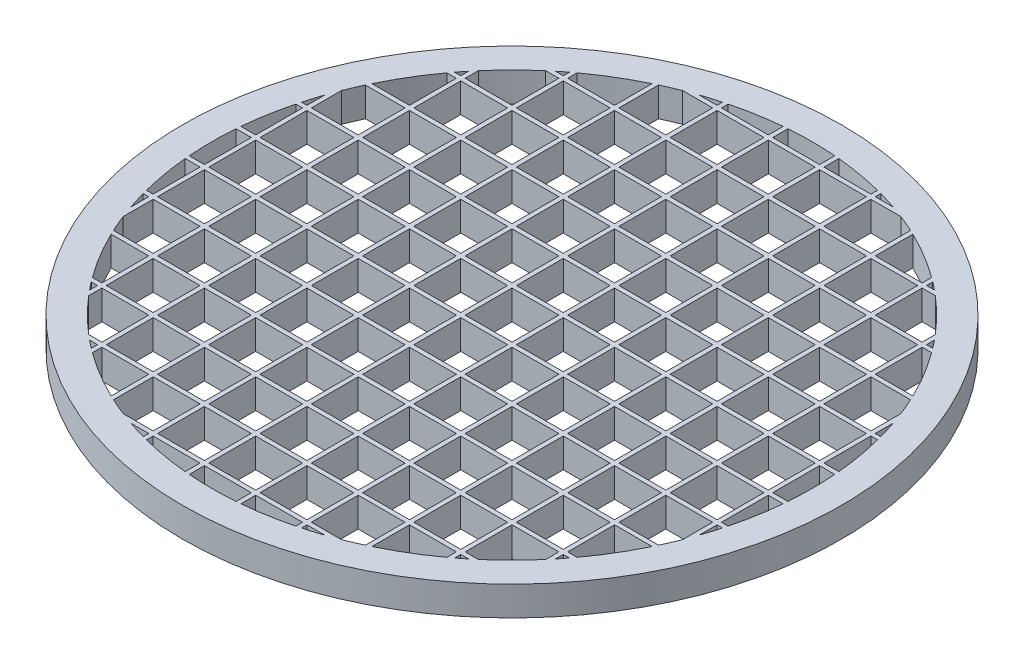
from build123d import *

# Parameters (mm, degrees)
SKETCH_1_R               = 2250
EXTRUDE_1_DEPTH          = 100
EXTRUDE_START            = 100
SKETCH_4_R               = 2250
EXTRUDE_2_DEPTH          = 100
SKETCH_9_W               = 320
SKETCH_9_H               = 320
CUT_EXTRUDE_5_DEPTH      = 3260.601202601
PATTERN_CIRCULAR_1_COUNT = 4
SKETCH_10_R              = 2250
SKETCH_10_R_2            = 2050
EXTRUDE_3_DEPTH          = 200


with BuildPart() as part:
    # ｽｹｯﾁ1 → ﾎﾞｽ - 押し出し1 (new body)
    with BuildSketch(Plane(origin=(0, 0, 0), x_dir=(1, 0, 0), z_dir=(0, 1, 0))):
        with Locations(Location((0, 0, 0), (0, 0, 270))):
            Circle(SKETCH_1_R)
    extrude(amount=-EXTRUDE_1_DEPTH)

    # ｽｹｯﾁ4 → ﾎﾞｽ - 押し出し2 (add)
    with BuildSketch(Plane(origin=(0, 0, 0), x_dir=(1, 0, 0), z_dir=(0, 1, 0)).offset(EXTRUDE_START)):
        with Locations(Location((0, 0, 0), (0, 0, 270))):
            Circle(SKETCH_4_R)
    extrude(amount=-EXTRUDE_2_DEPTH)

    # ｽｹｯﾁ9 → ｶｯﾄ - 押し出し5 (cut, through all)
    with BuildSketch(Plane(origin=(0, 100, 100), x_dir=(1, 0, 0), z_dir=(0, 1, 0))):
        with Locations((0, 100)):
            Rectangle(SKETCH_9_W, SKETCH_9_H)
        with Locations((350, 100)):
            Rectangle(SKETCH_9_W, SKETCH_9_H)
        with Locations((700, 100)):
            Rectangle(SKETCH_9_W, SKETCH_9_H)
        with Locations((1050, 100)):
            Rectangle(SKETCH_9_W, SKETCH_9_H)
        with Locations((1400, 100)):
            Rectangle(SKETCH_9_W, SKETCH_9_H)
        with Locations((1750, 100)):
            Rectangle(SKETCH_9_W, SKETCH_9_H)
        with Locations((2100, 100)):
            Rectangle(SKETCH_9_W, SKETCH_9_H)
        with Locations((350, 450)):
            Rectangle(SKETCH_9_W, SKETCH_9_H)
        with Locations((700, 450)):
            Rectangle(SKETCH_9_W, SKETCH_9_H)
        with Locations((1050, 450)):
            Rectangle(SKETCH_9_W, SKETCH_9_H)
        with Locations((1400, 450)):
            Rectangle(SKETCH_9_W, SKETCH_9_H)
        with Locations((1750, 450)):
            Rectangle(SKETCH_9_W, SKETCH_9_H)
        with Locations((2100, 450)):
            Rectangle(SKETCH_9_W, SKETCH_9_H)
        with Locations((350, 800)):
            Rectangle(SKETCH_9_W, SKETCH_9_H)
        with Locations((700, 800)):
            Rectangle(SKETCH_9_W, SKETCH_9_H)
        with Locations((1050, 800)):
            Rectangle(SKETCH_9_W, SKETCH_9_H)
        with Locations((1400, 800)):
            Rectangle(SKETCH_9_W, SKETCH_9_H)
        with Locations((1750, 800)):
            Rectangle(SKETCH_9_W, SKETCH_9_H)
        with Locations((2100, 800)):
            Rectangle(SKETCH_9_W, SKETCH_9_H)
        with Locations((350, 1150)):
            Rectangle(SKETCH_9_W, SKETCH_9_H)
        with Locations((700, 1150)):
            Rectangle(SKETCH_9_W, SKETCH_9_H)
        with Locations((1050, 1150)):
            Rectangle(SKETCH_9_W, SKETCH_9_H)
        with Locations((1400, 1150)):
            Rectangle(SKETCH_9_W, SKETCH_9_H)
        with Locations((1750, 1150)):
            Rectangle(SKETCH_9_W, SKETCH_9_H)
        with Locations((2100, 1150)):
            Rectangle(SKETCH_9_W, SKETCH_9_H)
        with Locations((350, 1500)):
            Rectangle(SKETCH_9_W, SKETCH_9_H)
        with Locations((700, 1500)):
            Rectangle(SKETCH_9_W, SKETCH_9_H)
        with Locations((1050, 1500)):
            Rectangle(SKETCH_9_W, SKETCH_9_H)
        with Locations((1400, 1500)):
            Rectangle(SKETCH_9_W, SKETCH_9_H)
        with Locations((1750, 1500)):
            Rectangle(SKETCH_9_W, SKETCH_9_H)
        with Locations((350, 1850)):
            Rectangle(SKETCH_9_W, SKETCH_9_H)
        with Locations((700, 1850)):
            Rectangle(SKETCH_9_W, SKETCH_9_H)
        with Locations((1050, 1850)):
            Rectangle(SKETCH_9_W, SKETCH_9_H)
        with Locations((1400, 1850)):
            Rectangle(SKETCH_9_W, SKETCH_9_H)
        with Locations((350, 2200)):
            Rectangle(SKETCH_9_W, SKETCH_9_H)
        with Locations((700, 2200)):
            Rectangle(SKETCH_9_W, SKETCH_9_H)
        with Locations((1050, 2200)):
            Rectangle(SKETCH_9_W, SKETCH_9_H)
        with Locations((0, 450)):
            Rectangle(SKETCH_9_W, SKETCH_9_H)
        with Locations((0, 800)):
            Rectangle(SKETCH_9_W, SKETCH_9_H)
        with Locations((0, 1150)):
            Rectangle(SKETCH_9_W, SKETCH_9_H)
        with Locations((0, 1500)):
            Rectangle(SKETCH_9_W, SKETCH_9_H)
        with Locations((0, 1850)):
            Rectangle(SKETCH_9_W, SKETCH_9_H)
        with Locations((0, 2200)):
            Rectangle(SKETCH_9_W, SKETCH_9_H)
    cut_extrude_5 = extrude(amount=-CUT_EXTRUDE_5_DEPTH, mode=Mode.SUBTRACT)

    # 円形ﾊﾟﾀｰﾝ1: ｶｯﾄ - 押し出し5 ×4 about axis
    pattern_circular_1_axis = Axis((0, 0, 0), (0, 1, 0))
    for i in range(1, PATTERN_CIRCULAR_1_COUNT):
        add(cut_extrude_5.rotate(pattern_circular_1_axis, i * 360 / PATTERN_CIRCULAR_1_COUNT), mode=Mode.SUBTRACT)

    # ｽｹｯﾁ10 → ﾎﾞｽ - 押し出し3 (add)
    with BuildSketch(Plane(origin=(0, 100, 0), x_dir=(1, 0, 0), z_dir=(0, 1, 0))):
        with Locations(Location((0, 0, 0), (0, 0, 270))):
            Circle(SKETCH_10_R)
        Circle(SKETCH_10_R_2, mode=Mode.SUBTRACT)
    extrude(amount=-EXTRUDE_3_DEPTH)


solid = part.part
